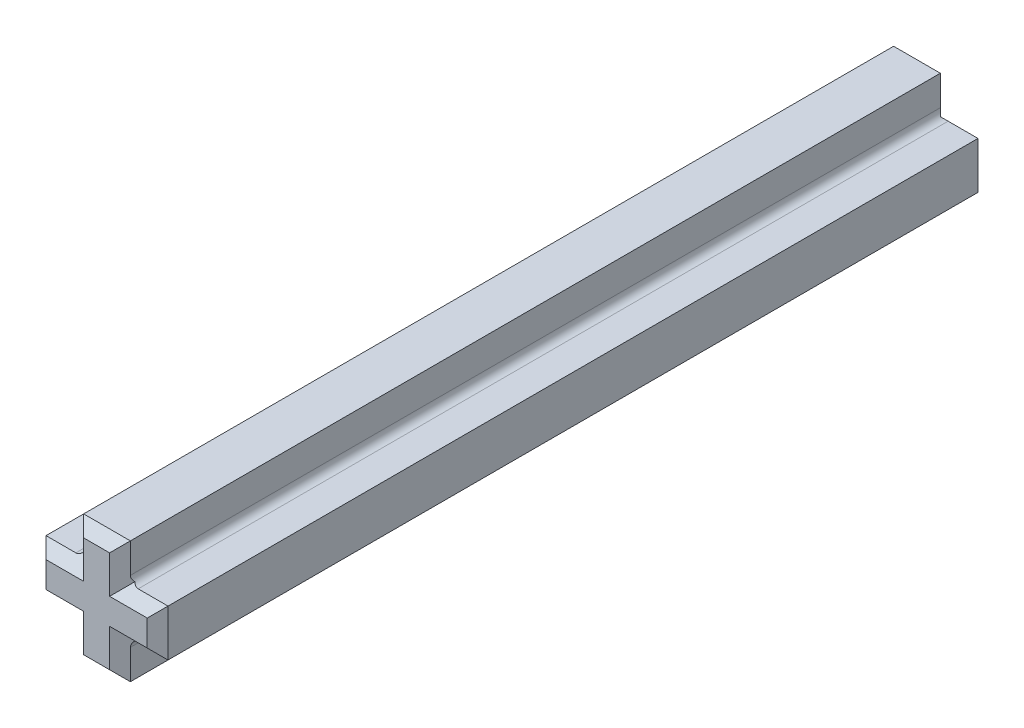
from build123d import *

# Parameters (mm, degrees)
BOSS_EXTRUDE1_DEPTH = 16
CHAMFER1_SIZE       = 0.4
FILLET1_R           = 0.3


with BuildPart() as part:
    # Sketch1 → Boss-Extrude1 (new, symmetric)
    with BuildSketch(Plane.XY):
        Polygon((0.9, -0.9), (0.9, -2.35), (-0.9, -2.35), (-0.9, -0.9), (-2.35, -0.9), (-2.35, 0.9), (-0.9, 0.9), (-0.9, 2.35), (0.9, 2.35), (0.9, 0.9), (2.35, 0.9), (2.35, -0.9), align=None)
    extrude(amount=BOSS_EXTRUDE1_DEPTH, both=True)

    # Chamfer1
    chamfer1_edges = [part.edges().sort_by_distance(p)[0] for p in [
        (0.9, -1.625, -16),
        (0, -2.35, -16),
        (1.625, 0.9, 16),
        (-0.9, -1.625, -16),
        (-1.625, -0.9, -16),
        (-2.35, 0, -16),
        (-1.625, 0.9, -16),
        (-0.9, 1.625, -16),
        (0, 2.35, -16),
        (0.9, 1.625, -16),
        (1.625, 0.9, -16),
        (2.35, 0, -16),
        (1.625, -0.9, -16),
        (0.9, 1.625, 16),
        (0, 2.35, 16),
        (-0.9, 1.625, 16),
        (-1.625, 0.9, 16),
        (-2.35, 0, 16),
        (-1.625, -0.9, 16),
        (-0.9, -1.625, 16),
        (0, -2.35, 16),
        (0.9, -1.625, 16),
        (1.625, -0.9, 16),
        (2.35, 0, 16),
    ]]
    chamfer(chamfer1_edges, length=CHAMFER1_SIZE)

    # Fillet1
    fillet1_edges = [part.edges().sort_by_distance(p)[0] for p in [
        (0.9, 0.9, 0),
        (-0.9, 0.9, 0),
        (-0.9, -0.9, 0),
        (0.9, -0.9, 0),
    ]]
    fillet(fillet1_edges, radius=FILLET1_R)


solid = part.part
